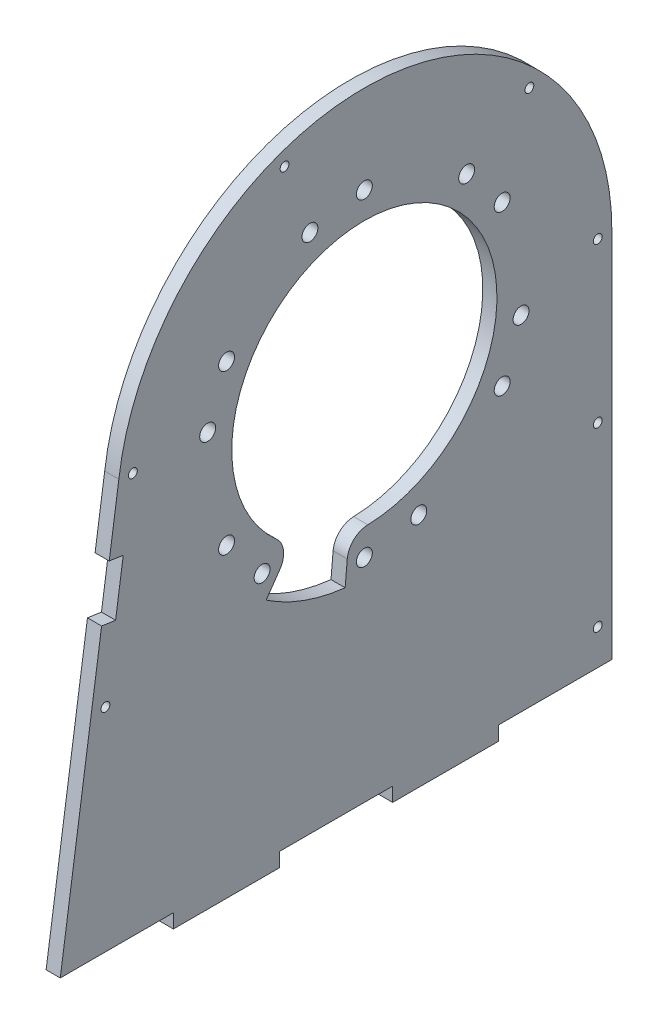
from build123d import *

# Parameters (mm, degrees)
AUFSATZ_LINEAR_AUSTRAGEN1_DEPTH      = 4
SKIZZE1_9_R                          = 10
SCHNITT_LINEAR_AUSTRAGEN1_DEPTH      = 6
F_4_1_4_1_DURCHMESSER_BOHRUNG1_D     = 4.1
F_4_1_4_1_DURCHMESSER_BOHRUNG1_DEPTH = 20
F_4_1_4_1_DURCHMESSER_BOHRUNG1_TIP   = 1.231764269
FASE1_SIZE                           = 1
SCHNITT_LINEAR_AUSTRAGEN2_DEPTH      = 251.325290812
SCHNITT_LINEAR_AUSTRAGEN2_DEPTH_BACK = 10
F_4_8_4_8_DURCHMESSER_BOHRUNG1_D     = 4.8
F_4_8_4_8_DURCHMESSER_BOHRUNG1_DEPTH = 4
F_4_8_4_8_DURCHMESSER_BOHRUNG1_TIP   = 1.442065486
SKIZZE21_R                           = 37.5
SCHNITT_LINEAR_AUSTRAGEN3_DEPTH      = 251.325290812
DURCHGANGSLOCH_F_R_M41_D             = 4.5
KREISMUSTER1_COUNT                   = 6
M3_GEWINDEBOHRUNG1_D                 = 2.5
M3_GEWINDEBOHRUNG1_DEPTH             = 8.5
M3_GEWINDEBOHRUNG1_TIP               = 0.751075774
SCHNITT_LINEAR_AUSTRAGEN4_DEPTH      = 251.325290812
SCHNITT_LINEAR_AUSTRAGEN5_DEPTH      = 251.325290812
VERRUNDUNG1_R                        = 6
SKIZZE31_W                           = 4
SKIZZE31_H                           = 30
AUFSATZ_LINEAR_AUSTRAGEN2_DEPTH      = 4


with BuildPart() as part:
    # Skizze1 → Aufsatz-Linear austragen1 (new body)
    with BuildSketch(Plane(origin=(0, 0, 0), x_dir=(0, 0, -1), z_dir=(1, 0, 0))):
        with BuildLine():
            Line((-120.903454086, -13.395859459), (-120.903454086, -24.075118314))
            ThreePointArc((-120.903454086, -24.075118314), (-140.766673303, -45.238586838), (-150.337818424, -72.639919993))
            Line((-150.337818424, -72.639919993), (-166.903454086, -186.520744783))
            Line((-166.903454086, -186.520744783), (-10.903454086, -186.520744783))
            Line((-10.903454086, -186.520744783), (-1.903454086, -186.520744783))
            Line((-1.903454086, -186.520744783), (-1.903454086, -81.52074478))
            ThreePointArc((-1.903454086, -81.52074478), (-41.654250272, -12.960552248), (-120.903454086, -13.395859459))
        make_face()
    extrude(amount=AUFSATZ_LINEAR_AUSTRAGEN1_DEPTH)

    # Skizze1<9> → Schnitt-Linear austragen1 (cut)
    with BuildSketch(Plane(origin=(0, 0, 0), x_dir=(0, 0, -1), z_dir=(1, 0, 0))):
        with Locations((-80.903454086, -81.52074478)):
            Circle(SKIZZE1_9_R)
    extrude(amount=SCHNITT_LINEAR_AUSTRAGEN1_DEPTH, mode=Mode.SUBTRACT)

    # Ø4.1 (4.1) Durchmesser Bohrung1
    with Locations(Plane.ZY):
        with Locations((80.903454086, -66.02074478), (96.403454086, -81.52074478), (80.903454086, -97.02074478), (65.403454086, -81.52074478)):
            Hole(F_4_1_4_1_DURCHMESSER_BOHRUNG1_D / 2, depth=F_4_1_4_1_DURCHMESSER_BOHRUNG1_DEPTH)
            with Locations((0, 0, -(F_4_1_4_1_DURCHMESSER_BOHRUNG1_DEPTH + F_4_1_4_1_DURCHMESSER_BOHRUNG1_TIP / 2))):  # 118° drill point
                Cone(0, F_4_1_4_1_DURCHMESSER_BOHRUNG1_D / 2, F_4_1_4_1_DURCHMESSER_BOHRUNG1_TIP, mode=Mode.SUBTRACT)

    # Fase1
    fase1_edges = [part.edges().sort_by_distance(p)[0] for p in [
        (0, -97.02074478, 82.953454086),
        (4, -97.02074478, 82.953454086),
        (0, -81.52074478, 67.453454086),
        (4, -81.52074478, 67.453454086),
        (0, -66.02074478, 82.953454086),
        (4, -66.02074478, 82.953454086),
        (0, -81.52074478, 98.453454086),
        (4, -81.52074478, 98.453454086),
    ]]
    chamfer(fase1_edges, length=FASE1_SIZE)

    # Skizze1<18> → Schnitt-Linear austragen2 (cut, two sides: drawn at the far end of the back side and taken through both)
    with BuildSketch(Plane(origin=(0, 0, 0), x_dir=(0, 0, -1), z_dir=(1, 0, 0)).offset(-SCHNITT_LINEAR_AUSTRAGEN2_DEPTH_BACK)):
        with BuildLine():
            ThreePointArc((-1.903454086, -81.52074478), (-41.654250272, -12.960552248), (-120.903454086, -13.395859459))
            Line((-120.903454086, -13.395859459), (-120.903454086, -24.075118314))
            ThreePointArc((-120.903454086, -24.075118314), (-48.499750594, -19.47237655), (-10.903454086, -81.52074478))
            Line((-10.903454086, -81.52074478), (-10.903454086, -186.520744783))
            Line((-10.903454086, -186.520744783), (-1.903454086, -186.520744783))
            Line((-1.903454086, -186.520744783), (-1.903454086, -81.52074478))
        make_face()
    extrude(amount=SCHNITT_LINEAR_AUSTRAGEN2_DEPTH + SCHNITT_LINEAR_AUSTRAGEN2_DEPTH_BACK, mode=Mode.SUBTRACT)

    # Ø4.8 (4.8) Durchmesser Bohrung1
    with Locations(Plane(origin=(4, 0, 0), x_dir=(0, 0, -1), z_dir=(1, 0, 0))):
        with Locations((-80.903454086, -46.52074478), (-80.903454086, -116.52074478)):
            Hole(F_4_8_4_8_DURCHMESSER_BOHRUNG1_D / 2, depth=F_4_8_4_8_DURCHMESSER_BOHRUNG1_DEPTH)
            with Locations((0, 0, -(F_4_8_4_8_DURCHMESSER_BOHRUNG1_DEPTH + F_4_8_4_8_DURCHMESSER_BOHRUNG1_TIP / 2))):  # 118° drill point
                Cone(0, F_4_8_4_8_DURCHMESSER_BOHRUNG1_D / 2, F_4_8_4_8_DURCHMESSER_BOHRUNG1_TIP, mode=Mode.SUBTRACT)

    # Skizze21 → Schnitt-Linear austragen3 (cut, through all)
    with BuildSketch(Plane.YZ.offset(4)):
        with Locations((-81.52074478, 80.903454086)):
            Circle(SKIZZE21_R)
    extrude(amount=-SCHNITT_LINEAR_AUSTRAGEN3_DEPTH, mode=Mode.SUBTRACT)

    # Durchgangsloch für M41 (through all)
    with Locations(Plane(origin=(4, 0, 0), x_dir=(0, 0, -1), z_dir=(1, 0, 0))):
        with Locations((-80.903454086, -126.52074478), (-65.512547636, -123.806912715)):
            durchgangsloch_f_r_m41 = Hole(DURCHGANGSLOCH_F_R_M41_D / 2)

    # Kreismuster1: Durchgangsloch für M41 ×6 about axis
    kreismuster1_axis = Axis((4, -81.52074478, 80.903454086), (1, 0, 0))
    for i in range(1, KREISMUSTER1_COUNT):
        add(durchgangsloch_f_r_m41.rotate(kreismuster1_axis, i * 360 / KREISMUSTER1_COUNT), mode=Mode.SUBTRACT)

    # M3 Gewindebohrung1
    with Locations(Plane.YZ.offset(4)):
        with Locations((-176.520744783, 14.903454086), (-126.520744783, 14.903454086), (-34.851697221, 34.234406527), (-19.501031808, 103.476783545), (-81.52074478, 14.903454086), (-73.147395695, 146.370140462), (-126.520744783, 154.133475978)):
            Hole(M3_GEWINDEBOHRUNG1_D / 2, depth=M3_GEWINDEBOHRUNG1_DEPTH)
            with Locations((0, 0, -(M3_GEWINDEBOHRUNG1_DEPTH + M3_GEWINDEBOHRUNG1_TIP / 2))):  # 118° drill point
                Cone(0, M3_GEWINDEBOHRUNG1_D / 2, M3_GEWINDEBOHRUNG1_TIP, mode=Mode.SUBTRACT)

    # Skizze29 → Schnitt-Linear austragen4 (cut, through all)
    with BuildSketch(Plane.YZ.offset(4)):
        Polygon((-106.153245921, 155.212823046), (-106.729044518, 151.254482993), (-91.885269319, 149.095238254), (-91.309470722, 153.053578307), align=None)
    extrude(amount=-SCHNITT_LINEAR_AUSTRAGEN4_DEPTH, mode=Mode.SUBTRACT)

    # Skizze30 → Schnitt-Linear austragen5 (cut, through all)
    with BuildSketch(Plane.YZ.offset(4)):
        with BuildLine():
            Line((-118.770131027, 85.231643571), (-131.223971881, 86.3430511))
            ThreePointArc((-131.223971881, 86.3430511), (-128.505375819, 98.004461252), (-123.092131269, 108.685099562))
            Line((-123.092131269, 108.685099562), (-112.837536697, 101.53131253))
            ThreePointArc((-112.837536697, 101.53131253), (-116.759218059, 93.72920946), (-118.770131027, 85.231643571))
        make_face()
    extrude(amount=-SCHNITT_LINEAR_AUSTRAGEN5_DEPTH, mode=Mode.SUBTRACT)

    # Verrundung1
    verrundung1_edges = [part.edges().sort_by_distance(p)[0] for p in [
        (2, -118.770131027, 85.231643571),
        (2, -112.837536697, 101.53131253),
    ]]
    fillet(verrundung1_edges, radius=VERRUNDUNG1_R)

    # Skizze31 → Aufsatz-Linear austragen2 (add)
    with BuildSketch(Plane.XZ.offset(186.520744783)):
        with Locations((2, 57.903454086)):
            Rectangle(SKIZZE31_W, SKIZZE31_H)
        with Locations((2, 119.903454086)):
            Rectangle(SKIZZE31_W, SKIZZE31_H)
    extrude(amount=AUFSATZ_LINEAR_AUSTRAGEN2_DEPTH)


solid = part.part
